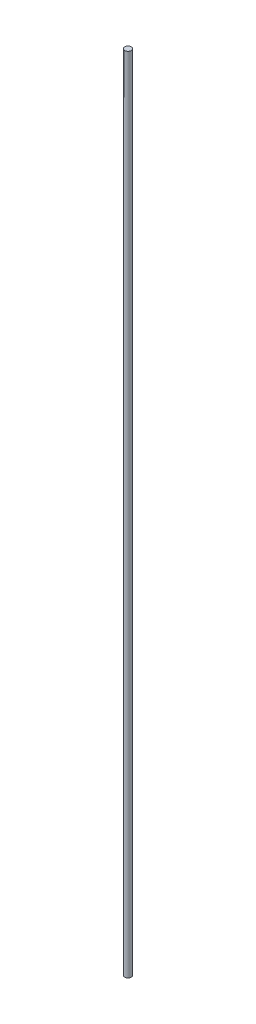
from build123d import *

# Parameters (mm, degrees)
SKETCH1_R           = 5.08
BOSS_EXTRUDE1_DEPTH = 1244.6


with BuildPart() as part:
    # Sketch1 → Boss-Extrude1 (new body)
    with BuildSketch(Plane(origin=(0, 0, 0), x_dir=(1, 0, 0), z_dir=(0, 1, 0))):
        with Locations(Location((0, 0, 0), (0, 0, 270))):
            Circle(SKETCH1_R)
    extrude(amount=BOSS_EXTRUDE1_DEPTH)


solid = part.part
